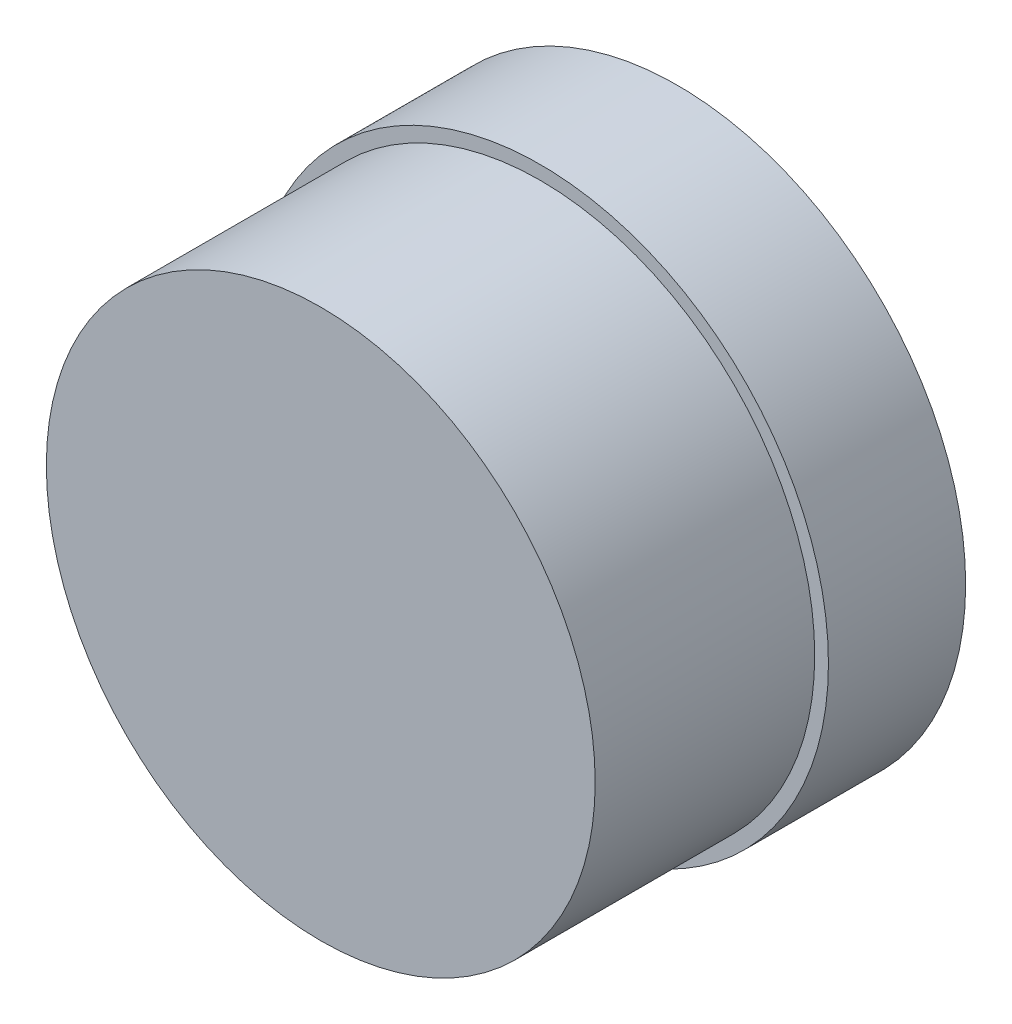
from build123d import *

# Parameters (mm, degrees)
SKETCH1_R           = 10.5
BOSS_EXTRUDE1_DEPTH = 5
SKETCH2_R           = 10
BOSS_EXTRUDE2_DEPTH = 8


with BuildPart() as part:
    # Sketch1 → Boss-Extrude1 (new body)
    with BuildSketch(Plane.XY):
        Circle(SKETCH1_R)
    extrude(amount=BOSS_EXTRUDE1_DEPTH)

    # Sketch2 → Boss-Extrude2 (add)
    with BuildSketch(Plane.XY.offset(5)):
        Circle(SKETCH2_R)
    extrude(amount=BOSS_EXTRUDE2_DEPTH)


solid = part.part
